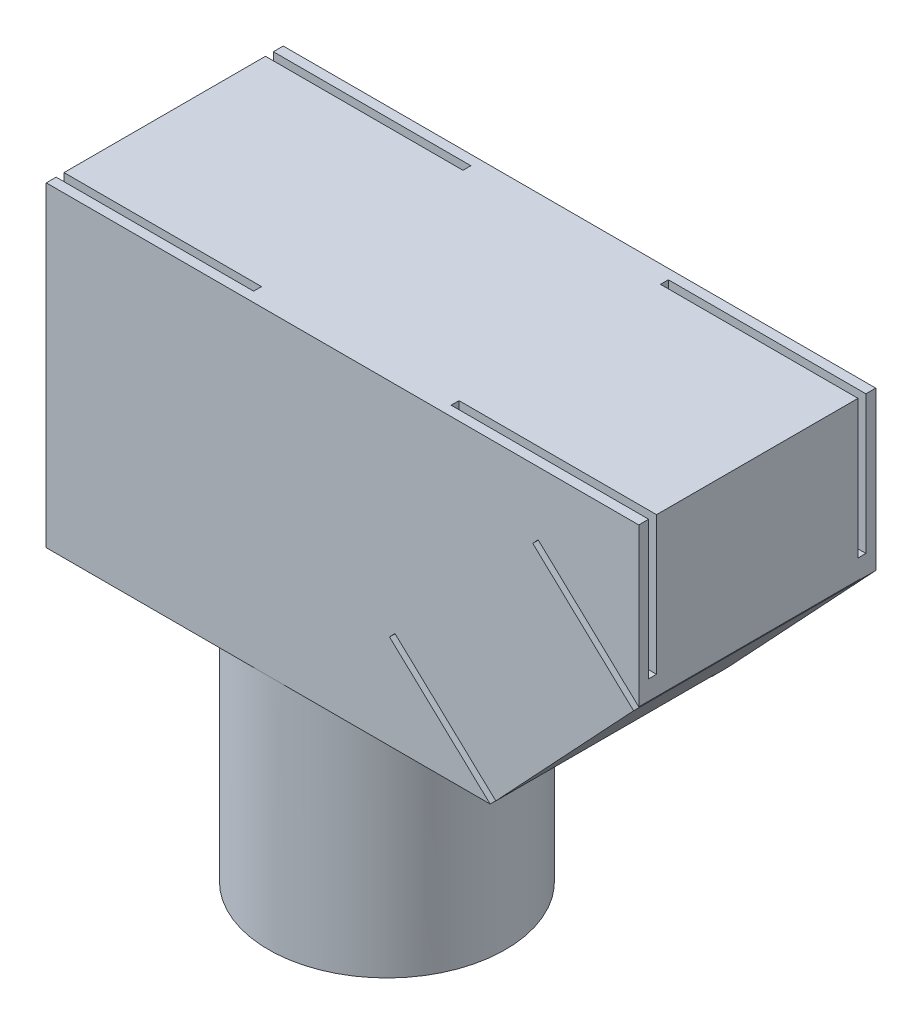
from build123d import *

# Parameters (mm, degrees)
SKETCH_1_W           = 150
SKETCH_1_H           = 80
EXTRUDE_1_DEPTH      = 60
CUT_EXTRUDE_2_DEPTH  = 60
SKETCH_3_W           = 50
SKETCH_3_H           = 2
CUT_EXTRUDE_3_DEPTH  = 35
SKETCH_4_W           = 2
SKETCH_4_H           = 50
CUT_EXTRUDE_4_DEPTH  = 35
SKETCH_5_R           = 30
EXTRUDE_2_DEPTH      = 60
CUT_EXTRUDE_5_DEPTH  = 58
SKETCH_7_R           = 20
CUT_EXTRUDE_8_DEPTH  = 62
SKETCH_8_W           = 58.287497292
SKETCH_8_H           = 2
CUT_EXTRUDE_12_DEPTH = 35
SKETCH_10_W          = 2
SKETCH_10_H          = 50
EXTRUDE_6_DEPTH      = 2


with BuildPart() as part:
    # 草图1 → 凸台-拉伸1 (new body)
    with BuildSketch(Plane.XY):
        Rectangle(SKETCH_1_W, SKETCH_1_H)
    extrude(amount=EXTRUDE_1_DEPTH)

    # 草图2 → 切除-拉伸2 (cut)
    with BuildSketch(Plane.XY.offset(60)):
        Polygon((75, 0), (37.5, -40), (75, -40), align=None)
    extrude(amount=-CUT_EXTRUDE_2_DEPTH, mode=Mode.SUBTRACT)

    # 草图3 → 切除-拉伸3 (cut)
    with BuildSketch(Plane(origin=(0, 40, 0), x_dir=(1, 0, 0), z_dir=(0, 1, 0))):
        with Locations((-50, -56.5)):
            Rectangle(SKETCH_3_W, SKETCH_3_H)
        with Locations((-50, -3.5)):
            Rectangle(SKETCH_3_W, SKETCH_3_H)
        with Locations((50, -56.5)):
            Rectangle(SKETCH_3_W, SKETCH_3_H)
        with Locations((50, -3.5)):
            Rectangle(SKETCH_3_W, SKETCH_3_H)
    extrude(amount=-CUT_EXTRUDE_3_DEPTH, mode=Mode.SUBTRACT)

    # 草图4 → 切除-拉伸4 (cut)
    with BuildSketch(Plane(origin=(39.916839917, -37.422037422, 0), x_dir=(0, 0, -1), z_dir=(0.7295372041400852, -0.6839411288813299, 0))):
        with Locations((-3, 23.880944417)):
            Rectangle(SKETCH_4_W, SKETCH_4_H)
        with Locations((-57, 23.880944417)):
            Rectangle(SKETCH_4_W, SKETCH_4_H)
    extrude(amount=-CUT_EXTRUDE_4_DEPTH, mode=Mode.SUBTRACT)

    # 草图5 → 凸台-拉伸2 (add)
    with BuildSketch(Plane.XZ.offset(40)):
        with Locations(Location((-18.75, 30, 0), (0, 0, 270))):
            Circle(SKETCH_5_R)
    extrude(amount=EXTRUDE_2_DEPTH)

    # 草图6 → 切除-拉伸5 (cut)
    with BuildSketch(Plane(origin=(0, 0, 0), x_dir=(-1, 0, 0), z_dir=(0, 0, -1))):
        Polygon((73, -38), (73, 38), (-73, 38), (-73, 0.79089496), (-36.633535975, -38), align=None)
    extrude(amount=-CUT_EXTRUDE_5_DEPTH, mode=Mode.SUBTRACT)

    # 草图7 → 切除-拉伸8 (cut)
    with BuildSketch(Plane.XZ.offset(100)):
        with Locations(Location((-18.75, 30, 0), (0, 0, 270))):
            Circle(SKETCH_7_R)
    extrude(amount=-CUT_EXTRUDE_8_DEPTH, mode=Mode.SUBTRACT)

    # 草图8 → 切除-拉伸12 (cut)
    with BuildSketch(Plane(origin=(39.916839917, -37.422037422, 0), x_dir=(0, 0, -1), z_dir=(0.7295372041400852, -0.6839411288813299, 0))):
        with Locations((-33.143748646, 50.380944417)):
            Rectangle(SKETCH_8_W, SKETCH_8_H)
        with Locations((-33.143748646, -2.619055583)):
            Rectangle(SKETCH_8_W, SKETCH_8_H)
    extrude(amount=-CUT_EXTRUDE_12_DEPTH, mode=Mode.SUBTRACT)

    # 草图10 → 凸台-拉伸6 (add)
    with BuildSketch(Plane(origin=(39.916839917, -37.422037422, 0), x_dir=(0, 0, -1), z_dir=(0.7295372041400852, -0.6839411288813299, 0))):
        with Locations((-57, 23.880944417)):
            Rectangle(SKETCH_10_W, SKETCH_10_H)
        with Locations((-3, 23.880944417)):
            Rectangle(SKETCH_10_W, SKETCH_10_H)
    extrude(amount=-EXTRUDE_6_DEPTH)


solid = part.part
